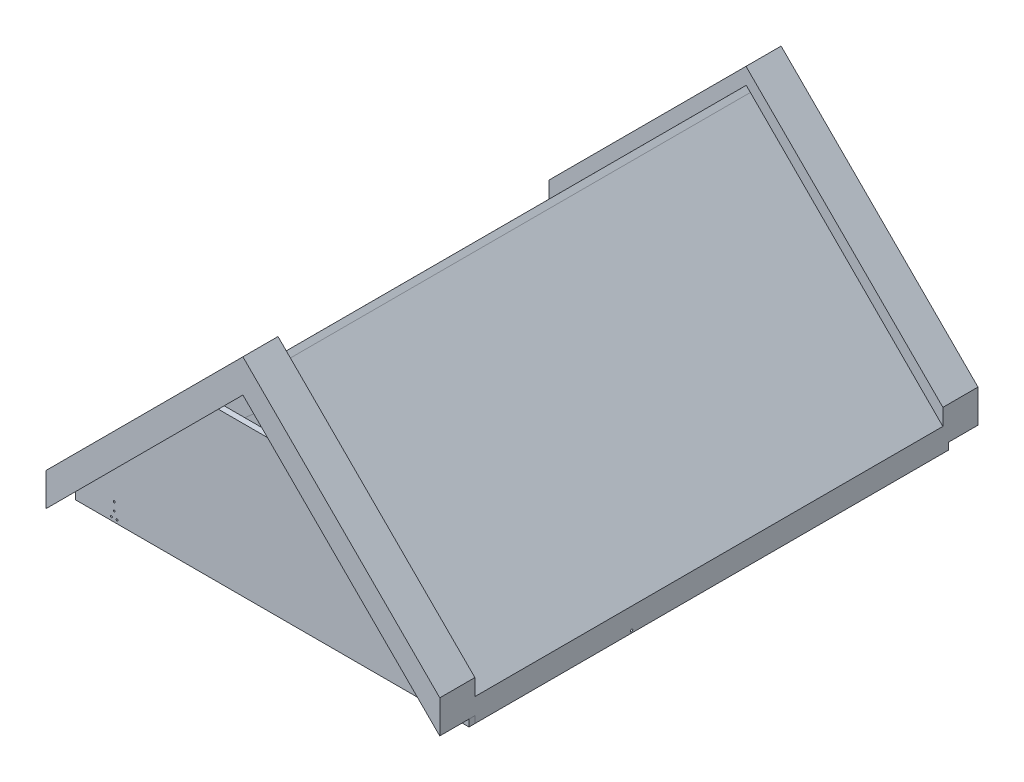
from build123d import *

# Parameters (mm, degrees)
BOSS_EXTRUDE1_DEPTH      = 2000
SHELL1_T                 = -10
SKETCH3_W                = 150
SKETCH3_H                = 1096.015510839
BOSS_EXTRUDE2_DEPTH      = 100
SKETCH7_W                = 150
SKETCH7_H                = 1089.949493661
BOSS_EXTRUDE4_DEPTH      = 100
CUT_EXTRUDE1_DEPTH       = 6
CUT_EXTRUDE1_DEPTH_BACK  = 6.066017
SKETCH8_W                = 150
SKETCH8_H                = 100
SKETCH9_W                = 150
SKETCH9_H                = 100
BOSS_EXTRUDE5_DEPTH      = 239.05
SKETCH10_W               = 150
SKETCH10_H               = 100
BOSS_EXTRUDE6_DEPTH      = 399.5
CUT_EXTRUDE4_DEPTH       = 1197.5
SKETCH14_W               = 2000
SKETCH14_H               = 100
BOSS_EXTRUDE7_DEPTH      = 25
SKETCH15_W               = 2000
SKETCH15_H               = 100
BOSS_EXTRUDE8_DEPTH      = 25
SKETCH16_W               = 2000
SKETCH16_H               = 25
BOSS_EXTRUDE9_DEPTH      = 1436
SKETCH17_W               = 25
SKETCH17_H               = 2000
BOSS_EXTRUDE10_DEPTH     = 1436
CUT_EXTRUDE11_DEPTH      = 1286
CUT_EXTRUDE12_DEPTH      = 1286
BOSS_EXTRUDE13_DEPTH     = 50
BOSS_EXTRUDE14_DEPTH     = 50
BOSS_EXTRUDE15_DEPTH     = 50
BOSS_EXTRUDE16_DEPTH     = 50
BOSS_EXTRUDE17_DEPTH     = 50
BOSS_EXTRUDE18_DEPTH     = 50
BOSS_EXTRUDE19_DEPTH     = 50
BOSS_EXTRUDE20_DEPTH     = 50
SKETCH34_W               = 1400
SKETCH34_H               = 2000
BOSS_EXTRUDE21_DEPTH     = 25
BOSS_EXTRUDE22_DEPTH     = 25
BOSS_EXTRUDE23_DEPTH     = 25
CUT_EXTRUDE16_DEPTH      = 2777.052898712
CUT_EXTRUDE16_DEPTH_BACK = 2777.052898712
SKETCH43_R               = 5
SKETCH45_R               = 4
CUT_EXTRUDE17_DEPTH      = 30


with BuildPart() as part:
    # Sketch1 → Boss-Extrude1 (new body)
    with BuildSketch(Plane.XY):
        Polygon((0, 0), (1400, 0), (700, 700), align=None)
    extrude(amount=BOSS_EXTRUDE1_DEPTH)

    # Shell1
    shell1_openings = [part.faces().sort_by_distance(p)[0] for p in [
        (700, 0, 1000),
    ]]
    offset(amount=SHELL1_T, openings=shell1_openings, kind=Kind.INTERSECTION)


with BuildPart() as body_2:
    # Sketch3 → Boss-Extrude2 (new body)
    with BuildSketch(Plane(origin=(0, 0, 0), x_dir=(0, 0, 1), z_dir=(-0.7071067811865477, 0.7071067811865475, 0))):
        with Locations((2075, 548.00775542)):
            Rectangle(SKETCH3_W, SKETCH3_H)
    extrude(amount=BOSS_EXTRUDE2_DEPTH)

    # Sketch7 → Boss-Extrude4 (add)
    with BuildSketch(Plane(origin=(700, 700, 0), x_dir=(0, 0, -1), z_dir=(0.7071067811865477, 0.7071067811865475, 0))):
        with Locations((-2075, -444.974746831)):
            Rectangle(SKETCH7_W, SKETCH7_H)
    extrude(amount=BOSS_EXTRUDE4_DEPTH)

    # Sketch8 → Cut-Extrude1 (cut, two sides: drawn at the far end of the back side and taken through both)
    with BuildSketch(Plane(origin=(775, 775, 0), x_dir=(0, 0, -1), z_dir=(0.7071067811865476, 0.7071067811865476, 0)).offset(-CUT_EXTRUDE1_DEPTH_BACK)):
        with Locations((-2075, 50)):
            Rectangle(SKETCH8_W, SKETCH8_H)
    extrude(amount=CUT_EXTRUDE1_DEPTH + CUT_EXTRUDE1_DEPTH_BACK, mode=Mode.SUBTRACT)

    # Sketch9 → Boss-Extrude5 (add)
    with BuildSketch(Plane(origin=(0, 0, 0), x_dir=(0, 0, 1), z_dir=(-0.7071067811865476, -0.7071067811865476, 0))):
        with Locations((2075, 50)):
            Rectangle(SKETCH9_W, SKETCH9_H)
    extrude(amount=BOSS_EXTRUDE5_DEPTH)

    # Sketch10 → Boss-Extrude6 (add)
    with BuildSketch(Plane(origin=(700, -700, 0), x_dir=(0, 0, -1), z_dir=(0.7071067811865476, -0.7071067811865476, 0))):
        with Locations((-2075, 1039.949493661)):
            Rectangle(SKETCH10_W, SKETCH10_H)
    extrude(amount=BOSS_EXTRUDE6_DEPTH)

    # Sketch13 → Cut-Extrude4 (cut)
    with BuildSketch(Plane.XY.offset(2150)):
        Polygon((-141.421356237, 0), (-141.421356237, -141.421356237), (-169.033876043, -169.033876043), (-239.744554161, -98.323197924), align=None)
        Polygon((1541.421356237, 0), (1753.199837203, -211.778480965), (1682.489159084, -282.489159084), (1541.244579542, -141.244579542), align=None)
    extrude(amount=-CUT_EXTRUDE4_DEPTH, mode=Mode.SUBTRACT)


with BuildPart() as body_3:
    # Mirror4: mirrored copy
    add(body_2.part.mirror(Plane.XY.offset(1000)))


with BuildPart() as body_2_1:
    add(body_2.part)

    add(body_3.part)  # Boss-Extrude7 merges body 3
    # Sketch14 → Boss-Extrude7 (add)
    with BuildSketch(Plane.ZY.offset(141.421356237)):
        with Locations((1000, -120.710678119)):
            Rectangle(SKETCH14_W, SKETCH14_H)
    extrude(amount=-BOSS_EXTRUDE7_DEPTH)

    # Sketch15 → Boss-Extrude8 (add)
    with BuildSketch(Plane(origin=(1541.418941738, -1.929185159, 0), x_dir=(0, 0, -1), z_dir=(0.999999216794127, -0.001251563475337267, 0))):
        with Locations((-1000, -118.693158413)):
            Rectangle(SKETCH15_W, SKETCH15_H)
    extrude(amount=-BOSS_EXTRUDE8_DEPTH)

    # Sketch16 → Boss-Extrude9 (add)
    with BuildSketch(Plane(origin=(-106.066017178, -106.066017178, 0), x_dir=(0, 0, -1), z_dir=(0.7071067811865483, 0.7071067811865468, 0))):
        with Locations((-1000, 37.5)):
            Rectangle(SKETCH16_W, SKETCH16_H)
    extrude(amount=BOSS_EXTRUDE9_DEPTH)

    # Sketch17 → Boss-Extrude10 (add)
    with BuildSketch(Plane(origin=(804.048443672, -806.063602678, 0), x_dir=(0.7079912163968599, 0.7062212383558673, 0), z_dir=(-0.7062212383558673, 0.7079912163968599, 0))):
        with Locations((1028.875241871, -1000)):
            Rectangle(SKETCH17_W, SKETCH17_H)
    extrude(amount=BOSS_EXTRUDE10_DEPTH)

    # Sketch27 → Cut-Extrude11 (cut)
    with BuildSketch(Plane(origin=(719.584743808, 717.785781949, 0), x_dir=(0, 0, 1), z_dir=(-0.7079912163968599, -0.7062212383558673, 0))):
        Polygon((0, 101.272137447), (0, 51.272098287), (2000, 51.272098287), (2000, 101.272137447), (2000, 297.477961859), (0, 297.477961859), align=None)
    extrude(amount=-CUT_EXTRUDE11_DEPTH, mode=Mode.SUBTRACT)

    # Sketch28 → Cut-Extrude12 (cut)
    with BuildSketch(Plane(origin=(-17.67766953, 17.67766953, 0), x_dir=(0, 0, -1), z_dir=(0.7071067811865468, -0.7071067811865483, 0))):
        Polygon((-2000, 1041.407346594), (0, 1041.407346594), (0, 1089.949493661), (0, 1286), (-2000, 1286), (-2000, 1089.949493661), align=None)
    extrude(amount=-CUT_EXTRUDE12_DEPTH, mode=Mode.SUBTRACT)

    # Sketch29 → Boss-Extrude13 (add)
    with BuildSketch(Plane(origin=(0, 0, 2000), x_dir=(-1, 0, 0), z_dir=(0, 0, -1))):
        Polygon((-701.03084385, 594.964826672), (-1466.590232409, -170.594561887), (-1516.207831122, -170.590922364), (-1516.320027106, -80.946331633), (-701.03084385, 736.386182909), (-630.320165731, 665.67550479), (116.421356237, -81.066017178), (116.421356237, -170.710678119), (64.640862765, -170.706879943), align=None)
    extrude(amount=BOSS_EXTRUDE13_DEPTH)

    # Sketch30 → Boss-Extrude14 (add)
    with BuildSketch(Plane(origin=(0, 0, 1359), x_dir=(-1, 0, 0), z_dir=(0, 0, -1))):
        Polygon((-701.03084385, 736.386182909), (-1516.320027106, -80.946331633), (-1516.207831122, -170.590922364), (-1466.590232409, -170.594561887), (-701.03084385, 594.964826672), (64.640862765, -170.706879943), (116.421356237, -170.710678119), (116.421356237, -81.066017178), align=None)
    extrude(amount=BOSS_EXTRUDE14_DEPTH)

    # Sketch31 → Boss-Extrude15 (add)
    with BuildSketch(Plane(origin=(0, 0, 691), x_dir=(-1, 0, 0), z_dir=(0, 0, -1))):
        Polygon((116.421356237, -81.066017178), (-701.03084385, 736.386182909), (-1516.320027106, -80.946331633), (-1516.207831122, -170.590922364), (-1466.590232409, -170.594561887), (-701.03084385, 594.964826672), (64.640862765, -170.706879943), (116.421356237, -170.710678119), align=None)
    extrude(amount=BOSS_EXTRUDE15_DEPTH)

    # Sketch33 → Boss-Extrude16 (add)
    with BuildSketch(Plane(origin=(0, 0, 50), x_dir=(-1, 0, 0), z_dir=(0, 0, -1))):
        Polygon((116.421356237, -170.710678119), (116.421356237, -81.066017178), (-701.03084385, 736.386182909), (-1516.320027106, -80.946331633), (-1516.207831122, -170.590922364), (-1466.590232409, -170.594561887), (-701.03084385, 594.964826672), (64.640862765, -170.706879943), align=None)
    extrude(amount=BOSS_EXTRUDE16_DEPTH)



with BuildPart() as body_3_2:
    # Sketch35 → Boss-Extrude17 (new body)
    with BuildSketch(Plane.XY.offset(2000)):
        Polygon((1341.704449553, -45.708779031), (60.357238147, -45.708779031), (-39.642761853, -145.708779031), (1441.704449553, -145.708779031), align=None)
    extrude(amount=-BOSS_EXTRUDE17_DEPTH)


with BuildPart() as body_4:
    # Sketch36 → Boss-Extrude18 (new body)
    with BuildSketch(Plane(origin=(0, 0, 1359), x_dir=(-1, 0, 0), z_dir=(0, 0, -1))):
        Polygon((39.642761853, -145.708779031), (-60.357238147, -45.708779031), (-1341.704449553, -45.708779031), (-1441.704449553, -145.708779031), align=None)
    extrude(amount=BOSS_EXTRUDE18_DEPTH)


with BuildPart() as body_5:
    # Sketch37 → Boss-Extrude19 (new body)
    with BuildSketch(Plane(origin=(0, 0, 691), x_dir=(-1, 0, 0), z_dir=(0, 0, -1))):
        Polygon((-1441.704449553, -145.708779031), (39.642761853, -145.708779031), (-60.357238147, -45.708779031), (-1341.704449553, -45.708779031), align=None)
    extrude(amount=BOSS_EXTRUDE19_DEPTH)


with BuildPart() as body_6:
    # Sketch38 → Boss-Extrude20 (new body)
    with BuildSketch(Plane(origin=(0, 0, 50), x_dir=(-1, 0, 0), z_dir=(0, 0, -1))):
        Polygon((-1341.704449553, -45.708779031), (-1441.704449553, -145.708779031), (39.642761853, -145.708779031), (-60.357238147, -45.708779031), align=None)
    extrude(amount=BOSS_EXTRUDE20_DEPTH)


with BuildPart() as body_7:
    # Sketch34 → Boss-Extrude21 (new body)
    with BuildSketch(Plane(origin=(0.012521253, -170.702137522, 0), x_dir=(0.9999999973097808, 7.335147241276342e-05, 0), z_dir=(7.335147241276342e-05, -0.9999999973097808, 0))):
        with Locations((701.018757721, 1000)):
            Rectangle(SKETCH34_W, SKETCH34_H)
    extrude(amount=-BOSS_EXTRUDE21_DEPTH)


with BuildPart() as body_8:
    # Sketch39 → Boss-Extrude22 (new body)
    with BuildSketch(Plane.XY.offset(2000)):
        Polygon((-64.640862765, -170.706879943), (1466.590232409, -170.594561887), (1516.207831122, -170.590922364), (1541.207811542, -170.62221145), (1541.244579542, -141.244579542), (930, 470), (470, 470), (-141.421356237, -141.421356237), (-141.421356237, -170.710678119), (-116.421356237, -170.710678119), align=None)
    extrude(amount=BOSS_EXTRUDE22_DEPTH)

    # Sketch45 → Cut-Extrude17 (cut)
    with BuildSketch(Plane.XY.offset(2000)):
        with Locations((13.031645739, -156.202062795)):
            Circle(SKETCH45_R)
        with Locations((37.031645739, -156.202062795)):
            Circle(SKETCH45_R)
        with Locations((25.031645739, -129.202062795)):
            Circle(SKETCH45_R)
        with Locations((25.031645739, -95.202062795)):
            Circle(SKETCH45_R)
        with Locations((1365.031641973, -156.099664126)):
            Circle(SKETCH45_R)
        with Locations((1389.031641973, -156.099664126)):
            Circle(SKETCH45_R)
        with Locations((1377.031641973, -129.099664126)):
            Circle(SKETCH45_R)
        with Locations((1377.031641973, -95.099664126)):
            Circle(SKETCH45_R)
    extrude(amount=CUT_EXTRUDE17_DEPTH, mode=Mode.SUBTRACT)


with BuildPart() as body_2_2:
    add(body_2_1.part)

    add(body_6.part)  # Boss-Extrude23 merges body 6

    add(body_7.part)  # Boss-Extrude23 merges body 7
    # Sketch40 → Boss-Extrude23 (add)
    with BuildSketch(Plane(origin=(0, 0, 0), x_dir=(-1, 0, 0), z_dir=(0, 0, -1))):
        Polygon((-1466.590232409, -170.594561887), (64.640862765, -170.706879943), (116.421356237, -170.710678119), (141.421356237, -170.710678119), (141.421356237, -141.421356237), (-470, 470), (-930, 470), (-1541.244579542, -141.244579542), (-1541.207811542, -170.62221145), (-1516.207831122, -170.590922364), align=None)
    extrude(amount=BOSS_EXTRUDE23_DEPTH)

    # Sketch43 → Cut-Extrude16 (cut, two sides: drawn at the far end of the back side and taken through both)
    with BuildSketch(Plane(origin=(0, 0, 0), x_dir=(0, 0, -1), z_dir=(1, 0, 0)).offset(-CUT_EXTRUDE16_DEPTH_BACK)):
        with Locations(Location((-1330, -160.62221145, 0), (0, 0, 270))):
            Circle(SKETCH43_R)
    extrude(amount=CUT_EXTRUDE16_DEPTH + CUT_EXTRUDE16_DEPTH_BACK, mode=Mode.SUBTRACT)


solid = Compound([part.part, body_3_2.part, body_4.part, body_5.part, body_8.part, body_2_2.part])
